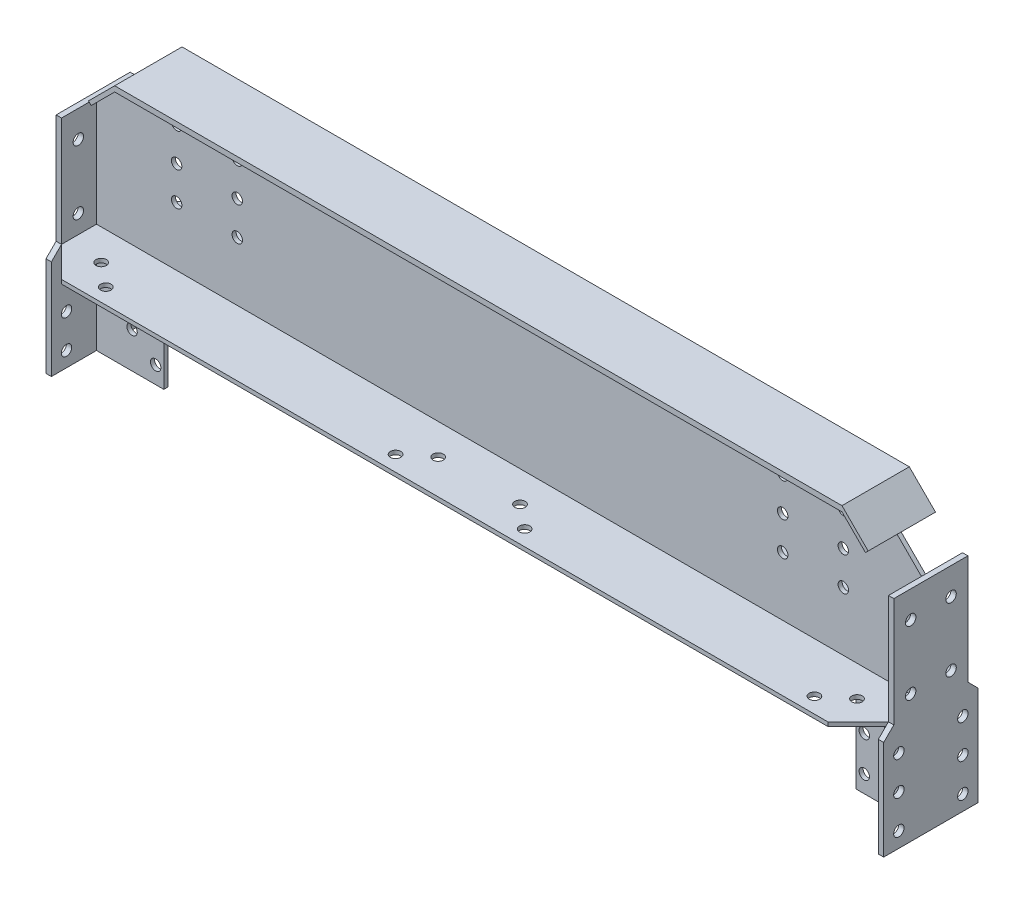
from build123d import *

# Parameters (mm, degrees)
EXTRUDE_1_DEPTH     = 200
SKETCH_2_3_W        = 16
SKETCH_2_3_H        = 650
EXTRUDE_2_DEPTH     = 140
SKETCH_2_4_W        = 200
SKETCH_2_4_H        = 313
EXTRUDE_3_DEPTH     = 6
EXTRUDE_4_DEPTH     = 100
SKETCH_3_R          = 15.5
CUT_EXTRUDE_5_DEPTH = 1353.439647452
SKETCH_6_R          = 15.5
CUT_EXTRUDE_6_DEPTH = 1353.439647452
SKETCH_7_R          = 15.5
CUT_EXTRUDE_7_DEPTH = 16
SKETCH_8_R          = 15.5
CUT_EXTRUDE_8_DEPTH = 12


with BuildPart() as part:
    # 草图2 → 拉伸1 (new, symmetric)
    with BuildSketch(Plane.XY):
        Polygon((0, 0), (0, 12), (-1228, 12), (-1228, 0), (-1028, 0), align=None)
    extrude(amount=EXTRUDE_1_DEPTH, both=True)

    # 草图2<3> → 拉伸2 (add, symmetric)
    with BuildSketch(Plane.XY):
        with Locations((-1236, 12)):
            Rectangle(SKETCH_2_3_W, SKETCH_2_3_H)
    extrude(amount=EXTRUDE_2_DEPTH, both=True)

    # 草图2<4> → 拉伸3 (add, symmetric)
    with BuildSketch(Plane.XY):
        Polygon((0, 473), (-1080, 473), (-1149.781745931, 403.218254069), (-1228, 325), (-1228, 12), (0, 12), align=None)
        with Locations((-1128, -156.5)):
            Rectangle(SKETCH_2_4_W, SKETCH_2_4_H)
    extrude(amount=EXTRUDE_3_DEPTH, both=True)

    # 草图2<5> → 拉伸4 (add, symmetric)
    with BuildSketch(Plane.XY):
        Polygon((-1149.781745931, 403.218254069), (-1080, 473), (-1096, 473), (-1157.781745931, 411.218254069), align=None)
        Polygon((-1096, 473), (-1080, 473), (0, 473), (0, 489), (-1080, 489), align=None)
    extrude(amount=EXTRUDE_4_DEPTH, both=True)

    # 草图3 → 拉伸5 (cut, through all)
    with BuildSketch(Plane.XY.offset(6)):
        with Locations((-990, 387)):
            Circle(SKETCH_3_R)
        with Locations((-810, 387)):
            Circle(SKETCH_3_R)
        with Locations((-990, 287)):
            Circle(SKETCH_3_R)
        with Locations((-810, 287)):
            Circle(SKETCH_3_R)
        with Locations((-990, 187)):
            Circle(SKETCH_3_R)
        with Locations((-810, 187)):
            Circle(SKETCH_3_R)
    extrude(amount=-CUT_EXTRUDE_5_DEPTH, mode=Mode.SUBTRACT)

    # 草图6 → 拉伸6 (cut, through all)
    with BuildSketch(Plane.XY.offset(6)):
        with Locations((-1122.413652083, -100.738221798)):
            Circle(SKETCH_6_R)
        with Locations((-1052.267682131, -157.125657451)):
            Circle(SKETCH_6_R)
        with Locations((-1122.413652083, -205.738221798)):
            Circle(SKETCH_6_R)
        with Locations((-1052.267682131, -262.125657451)):
            Circle(SKETCH_6_R)
    extrude(amount=-CUT_EXTRUDE_6_DEPTH, mode=Mode.SUBTRACT)

    # 草图7 → 拉伸7 (cut)
    with BuildSketch(Plane.ZY.offset(1244)):
        Polygon((-110, 12), (-110, 337), (-140, 337), (-140, -18), align=None)
        Polygon((140, 337), (110, 337), (110, 12), (140, -18), align=None)
        with Locations((60, 257)):
            Circle(SKETCH_7_R)
        with Locations((-60, 257)):
            Circle(SKETCH_7_R)
        with Locations((60, 67)):
            Circle(SKETCH_7_R)
        with Locations((-60, 67)):
            Circle(SKETCH_7_R)
        with Locations((95, -268)):
            Circle(SKETCH_7_R)
        with Locations((-95, -268)):
            Circle(SKETCH_7_R)
        with Locations((95, -168)):
            Circle(SKETCH_7_R)
        with Locations((-95, -168)):
            Circle(SKETCH_7_R)
        with Locations((95, -68)):
            Circle(SKETCH_7_R)
        with Locations((-95, -68)):
            Circle(SKETCH_7_R)
    extrude(amount=-CUT_EXTRUDE_7_DEPTH, mode=Mode.SUBTRACT)

    # 草图8 → 拉伸8 (cut)
    with BuildSketch(Plane.XZ):
        Polygon((-1228, 110), (-1138, 200), (-1228, 200), align=None)
        Polygon((-1228, -200), (-1138, -200), (-1228, -110), align=None)
        with Locations(Location((-1122.413652083, -97.738221798, 0), (0, 0, 270))):
            Circle(SKETCH_8_R)
        with Locations(Location((-1052.267682131, -154.125657451, 0), (0, 0, 270))):
            Circle(SKETCH_8_R)
        with Locations(Location((-1052.267682131, 154.125657451, 0), (0, 0, 90))):
            Circle(SKETCH_8_R)
        with Locations(Location((-1122.413652083, 97.738221798, 0), (0, 0, 90))):
            Circle(SKETCH_8_R)
        with Locations(Location((-191.732317869, -154.125657451, 0), (0, 0, 90))):
            Circle(SKETCH_8_R)
        with Locations(Location((-121.586347917, -97.738221798, 0), (0, 0, 90))):
            Circle(SKETCH_8_R)
        with Locations(Location((-191.732317869, 154.125657451, 0), (0, 0, 270))):
            Circle(SKETCH_8_R)
        with Locations(Location((-121.586347917, 97.738221798, 0), (0, 0, 270))):
            Circle(SKETCH_8_R)
    extrude(amount=-CUT_EXTRUDE_8_DEPTH, mode=Mode.SUBTRACT)

    # 镜向1: part across plane


with BuildPart() as part_1:
    add(part.part)
    add(part.part.mirror(Plane(origin=(0, 0, 200), x_dir=(0, 0, 1), z_dir=(1, 0, 0))))


solid = part_1.part
